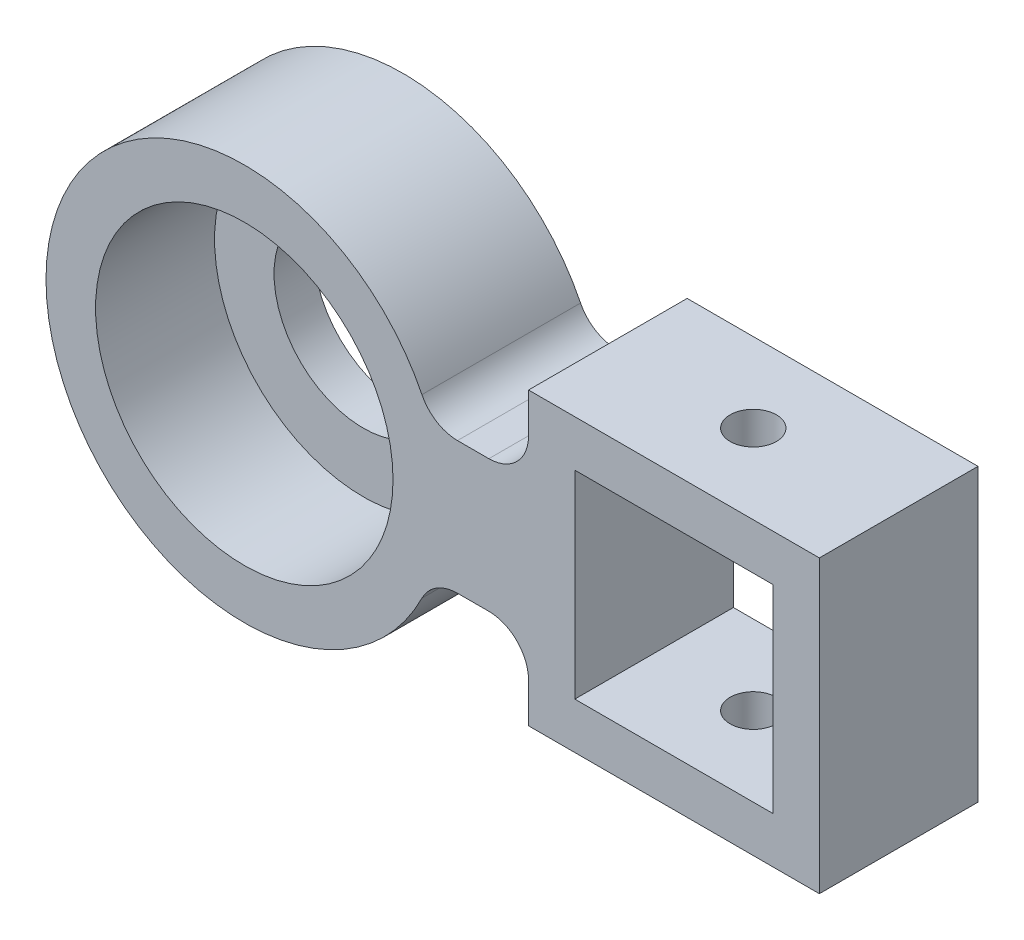
from build123d import *

# Parameters (mm, degrees)
SKETCH1_R           = 6.75
SKETCH1_W           = 15
SKETCH1_H           = 15
BOSS_EXTRUDE1_DEPTH = 12
CUT_EXTRUDE1_REACH  = 64.336
SKETCH2_R           = 1.75
FILLET1_R           = 3
SKETCH3_R           = 11.25
CUT_EXTRUDE2_DEPTH  = 9


with BuildPart() as part:
    # Sketch1 → Boss-Extrude1 (new body)
    with BuildSketch(Plane.XY):
        with BuildLine():
            Line((-18.868931919, 14.90275594), (3.131068081, 14.90275594))
            Line((3.131068081, 14.90275594), (3.131068081, -7.09724406))
            Line((3.131068081, -7.09724406), (-18.868931919, -7.09724406))
            Line((-18.868931919, -7.09724406), (-18.868931919, -1.09724406))
            Line((-18.868931919, -1.09724406), (-26.226796295, -1.09724406))
            ThreePointArc((-26.226796295, -1.09724406), (-55.368931919, 3.90275594), (-26.226796295, 8.90275594))
            Line((-26.226796295, 8.90275594), (-18.868931919, 8.90275594))
            Line((-18.868931919, 8.90275594), (-18.868931919, 14.90275594))
        make_face()
        with Locations((-40.368931919, 3.90275594)):
            Circle(SKETCH1_R, mode=Mode.SUBTRACT)
        with Locations((-7.868931919, 3.90275594)):
            Rectangle(SKETCH1_W, SKETCH1_H, mode=Mode.SUBTRACT)
    extrude(amount=BOSS_EXTRUDE1_DEPTH)

    # Cut-Extrude1: up to this face of the body (flat: up to its plane)
    cut_extrude1_end = Plane(part.part.faces().sort_by_distance((-7.868931919, 14.90275594, 6))[0])
    # Sketch2 → Cut-Extrude1 (cut, up to the picked face)
    with BuildSketch(Plane.XZ.offset(7.09724406), mode=Mode.PRIVATE) as cut_extrude1_sk1:
        with Locations(Location((-7.868931919, 6, 0), (0, 0, 270))):
            Circle(SKETCH2_R)
    cut_extrude1_tool1 = split(extrude(cut_extrude1_sk1.sketch, amount=-CUT_EXTRUDE1_REACH, mode=Mode.PRIVATE), bisect_by=cut_extrude1_end, keep=Keep.BOTH, mode=Mode.PRIVATE)
    add(cut_extrude1_tool1.solids().sort_by(Axis((-7.868932, -7.097244, 6), (0, 1, 0)))[0], mode=Mode.SUBTRACT)

    # Fillet1
    fillet1_edges = [part.edges().sort_by_distance(p)[0] for p in [
        (-18.868931919, -1.09724406, 6),
        (-26.226796295, -1.09724406, 6),
        (-26.226796295, 8.90275594, 6),
        (-18.868931919, 8.90275594, 6),
    ]]
    fillet(fillet1_edges, radius=FILLET1_R)

    # Sketch3 → Cut-Extrude2 (cut)
    with BuildSketch(Plane.XY.offset(12)):
        with Locations((-40.368931919, 3.90275594)):
            Circle(SKETCH3_R)
    extrude(amount=-CUT_EXTRUDE2_DEPTH, mode=Mode.SUBTRACT)


solid = part.part
